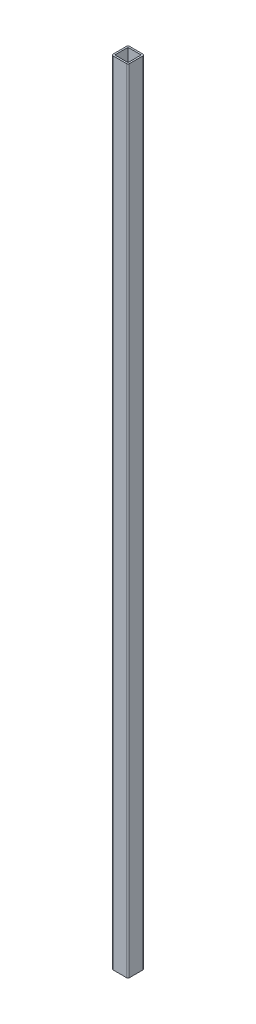
from build123d import *

# Parameters (mm, degrees)
SKETCH4_W           = 25.4
SKETCH4_H           = 25.4
BOSS_EXTRUDE6_DEPTH = 1219.2
SHELL1_T            = -2.54
FILLET1_R           = 2.54


with BuildPart() as part:
    # Sketch4 → Boss-Extrude6 (new body)
    with BuildSketch(Plane(origin=(0, 0, 0), x_dir=(1, 0, 0), z_dir=(0, 1, 0))):
        Rectangle(SKETCH4_W, SKETCH4_H)
    extrude(amount=BOSS_EXTRUDE6_DEPTH)

    # Shell1
    shell1_openings = [part.faces().sort_by_distance(p)[0] for p in [
        (0, 1219.2, 0),
        (0, 0, 0),
    ]]
    offset(amount=SHELL1_T, openings=shell1_openings, kind=Kind.INTERSECTION)

    # Fillet1
    fillet1_edges = [part.edges().sort_by_distance(p)[0] for p in [
        (12.7, 609.6, -12.7),
        (12.7, 609.6, 12.7),
        (-12.7, 609.6, 12.7),
        (-12.7, 609.6, -12.7),
    ]]
    fillet(fillet1_edges, radius=FILLET1_R)


solid = part.part
